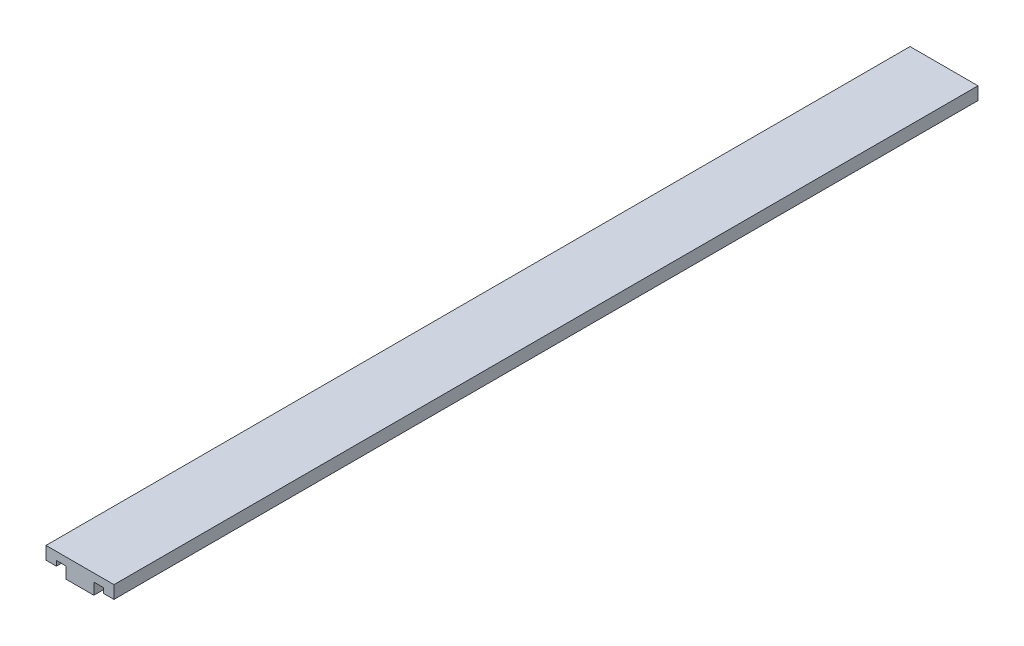
from build123d import *

# Parameters (mm, degrees)
RESSALTO_EXTRUS_O1_DEPTH = 150


with BuildPart() as part:
    # Esboço1 → Ressalto-extrusão1 (new body)
    with BuildSketch(Plane.XY):
        Polygon((-0.6000508, -33.5), (-0.6000508, -31.512433505), (1.0999492, -31.512433505), (1.0999492, -32.380433252), (2.8999492, -32.380433252), (2.8999492, -30.150433252), (-8.9000508, -30.150433252), (-8.9000508, -32.380433252), (-7.1000508, -32.380433252), (-7.1000508, -31.510435739), (-5.4000508, -31.510435739), (-5.4000508, -33.5), align=None)
    extrude(amount=-RESSALTO_EXTRUS_O1_DEPTH)


solid = part.part
